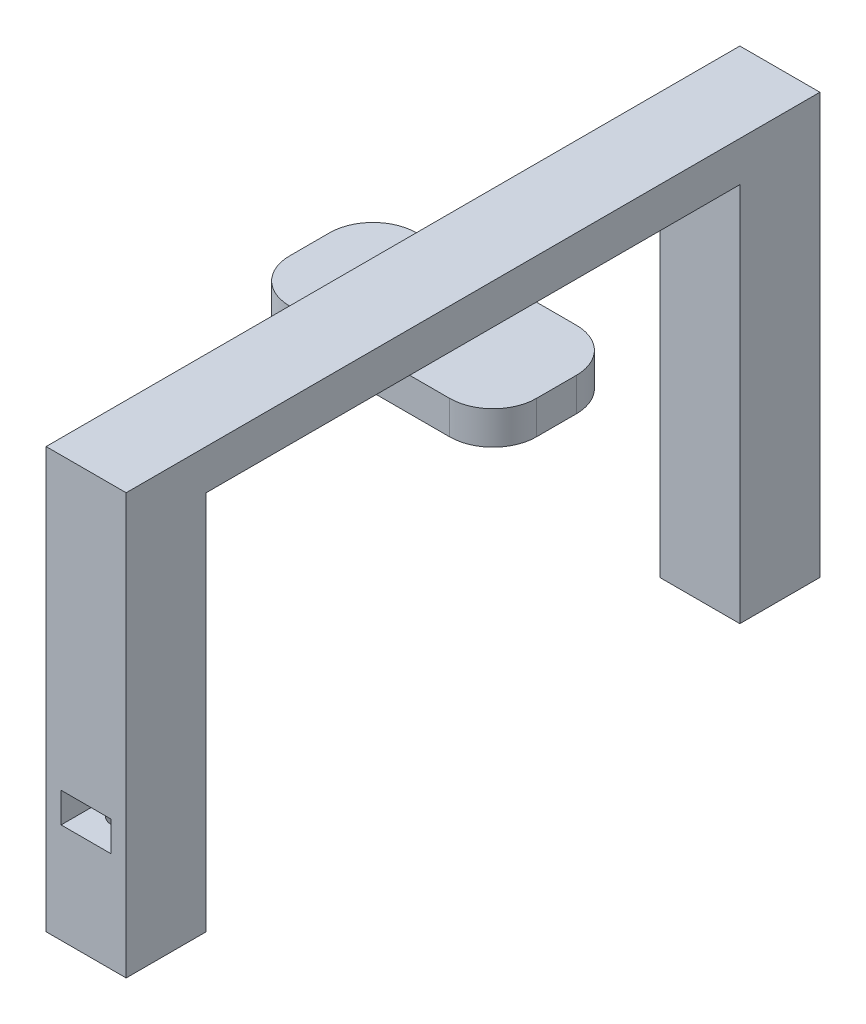
from build123d import *

# Parameters (mm, degrees)
ESQUISSE1_W             = 37
ESQUISSE1_H             = 19
BOSS_EXTRU_1_DEPTH      = 5
CONG_1_R                = 6.5
ESQUISSE4_W             = 12
ESQUISSE4_H             = 104
BOSS_EXTRU_2_DEPTH      = 6
ESQUISSE5_W             = 12
ESQUISSE5_H             = 12
BOSS_EXTRU_3_DEPTH      = 57
ESQUISSE6_R             = 2.2
ENL_V_MAT_EXTRU_1_DEPTH = 40
ESQUISSE7_W             = 7.5
ESQUISSE7_H             = 4.5
ENL_V_MAT_EXTRU_2_DEPTH = 10.5
ESQUISSE8_W             = 7.5
ESQUISSE8_H             = 4.5
ENL_V_MAT_EXTRU_3_DEPTH = 10.5


with BuildPart() as part:
    # Esquisse1 → Boss.-Extru.1 (new body)
    with BuildSketch(Plane(origin=(0, 0, 0), x_dir=(1, 0, 0), z_dir=(0, 1, 0))):
        with Locations((-4.867406947, 1.932441033)):
            Rectangle(ESQUISSE1_W, ESQUISSE1_H)
    extrude(amount=BOSS_EXTRU_1_DEPTH)

    # Congé1
    cong_1_edges = [part.edges().sort_by_distance(p)[0] for p in [
        (-23.367406947, 2.5, -11.432441033),
        (13.632593053, 2.5, -11.432441033),
        (13.632593053, 2.5, 7.567558967),
        (-23.367406947, 2.5, 7.567558967),
    ]]
    fillet(cong_1_edges, radius=CONG_1_R)

    # Esquisse4 → Boss.-Extru.2 (add)
    with BuildSketch(Plane(origin=(0, 5, 0), x_dir=(1, 0, 0), z_dir=(0, 1, 0))):
        with Locations((-4.867406947, 1.932441033)):
            Rectangle(ESQUISSE4_W, ESQUISSE4_H)
    extrude(amount=BOSS_EXTRU_2_DEPTH)

    # Esquisse5 → Boss.-Extru.3 (add)
    with BuildSketch(Plane(origin=(0, 5, 0), x_dir=(-1, 0, 0), z_dir=(0, -1, 0))):
        with Locations((4.867406947, 47.932441033)):
            Rectangle(ESQUISSE5_W, ESQUISSE5_H)
        with Locations((4.867406947, -44.067558967)):
            Rectangle(ESQUISSE5_W, ESQUISSE5_H)
    extrude(amount=BOSS_EXTRU_3_DEPTH)

    # Esquisse6 → Enlèv. mat.-Extru.1 (cut)
    with BuildSketch(Plane.XZ.offset(52)):
        with Locations(Location((-4.867406947, 44.067558967, 0), (0, 0, 270))):
            Circle(ESQUISSE6_R)
        with Locations(Location((-4.867406947, -47.932441033, 0), (0, 0, 270))):
            Circle(ESQUISSE6_R)
    extrude(amount=-ENL_V_MAT_EXTRU_1_DEPTH, mode=Mode.SUBTRACT)

    # Esquisse7 → Enlèv. mat.-Extru.2 (cut)
    with BuildSketch(Plane.XY.offset(50.067558967)):
        with Locations((-4.867406947, -34.75)):
            Rectangle(ESQUISSE7_W, ESQUISSE7_H)
    extrude(amount=-ENL_V_MAT_EXTRU_2_DEPTH, mode=Mode.SUBTRACT)

    # Esquisse8 → Enlèv. mat.-Extru.3 (cut)
    with BuildSketch(Plane(origin=(0, 0, -53.932441033), x_dir=(-1, 0, 0), z_dir=(0, 0, -1))):
        with Locations((4.867406947, -34.75)):
            Rectangle(ESQUISSE8_W, ESQUISSE8_H)
    extrude(amount=-ENL_V_MAT_EXTRU_3_DEPTH, mode=Mode.SUBTRACT)


solid = part.part
